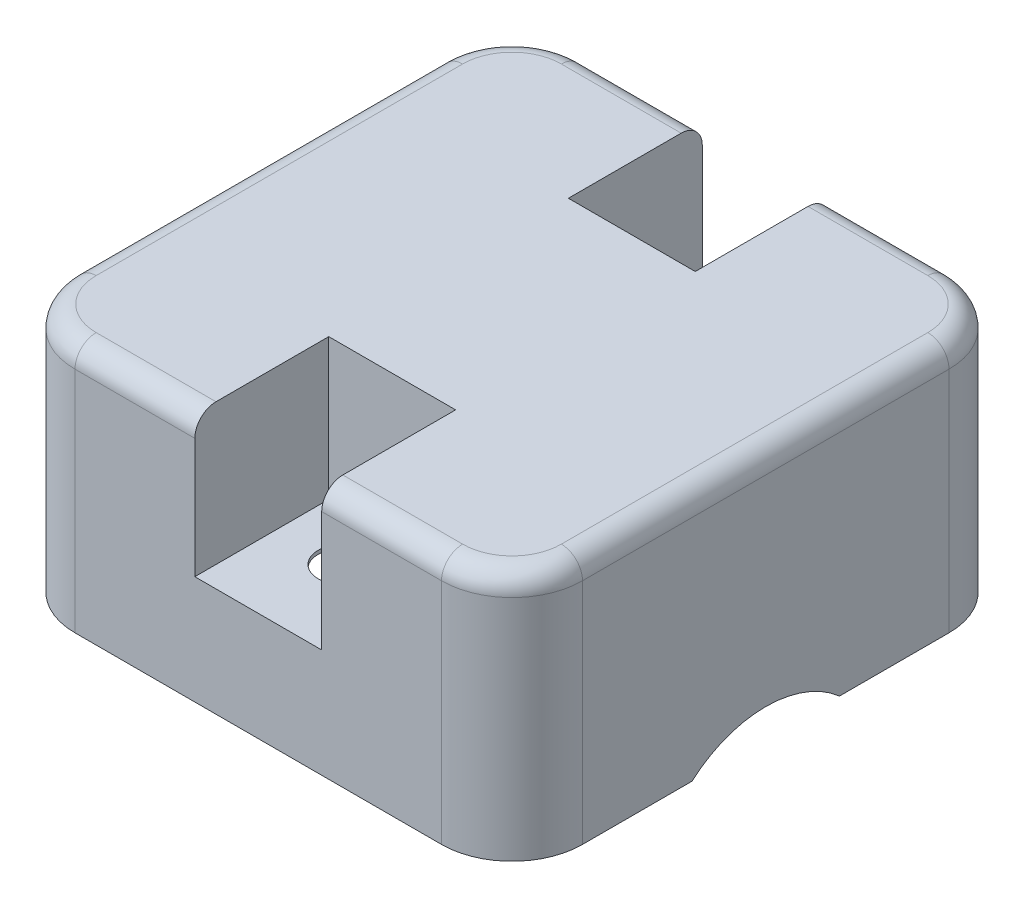
from build123d import *

# Parameters (mm, degrees)
BOSS_EXTRUDE1_DEPTH = 20
BOSS_EXTRUDE2_DEPTH = 2
SKETCH5_W           = 20
SKETCH5_H           = 20
SKETCH5_R           = 3.5
BOSS_EXTRUDE3_DEPTH = 22
SKETCH6_W           = 18
SKETCH6_H           = 19
CUT_EXTRUDE1_DEPTH  = 20
SKETCH7_W           = 20
SKETCH7_H           = 19
CUT_EXTRUDE2_DEPTH  = 1.5
FILLET1_R           = 3
SKETCH8_R           = 15.7
CUT_EXTRUDE3_DEPTH  = 121.5
BOSS_EXTRUDE6_START = 13.4
BOSS_EXTRUDE6_DEPTH = 13.4
SKETCH12_W          = 1
SKETCH12_H          = 30.481485494
BOSS_EXTRUDE7_DEPTH = 23.4
CUT_EXTRUDE4_DEPTH  = 93.4


with BuildPart() as part:
    # Sketch3 → Boss-Extrude1 (new body)
    with BuildSketch(Plane(origin=(0, 0, 0), x_dir=(1, 0, 0), z_dir=(0, 1, 0))):
        with BuildLine():
            Line((36, -26), (36, 26))
            ThreePointArc((36, 26), (33.071067812, 33.071067812), (26, 36))
            Line((26, 36), (-26, 36))
            ThreePointArc((-26, 36), (-33.071067812, 33.071067812), (-36, 26))
            Line((-36, 26), (-36, -26))
            ThreePointArc((-36, -26), (-33.071067812, -33.071067812), (-26, -36))
            Line((-26, -36), (26, -36))
            ThreePointArc((26, -36), (33.071067812, -33.071067812), (36, -26))
        make_face()
        with BuildLine():
            Line((-35, 25), (-35, -25))
            ThreePointArc((-35, -25), (-32.071067812, -32.071067812), (-25, -35))
            Line((-25, -35), (25, -35))
            ThreePointArc((25, -35), (32.071067812, -32.071067812), (35, -25))
            Line((35, -25), (35, 25))
            ThreePointArc((35, 25), (32.071067812, 32.071067812), (25, 35))
            Line((25, 35), (-25, 35))
            ThreePointArc((-25, 35), (-32.071067812, 32.071067812), (-35, 25))
        make_face(mode=Mode.SUBTRACT)
    extrude(amount=BOSS_EXTRUDE1_DEPTH)

    # Sketch4 → Boss-Extrude2 (add)
    with BuildSketch(Plane(origin=(0, 20, 0), x_dir=(1, 0, 0), z_dir=(0, 1, 0))):
        with BuildLine():
            Line((0, 36), (0, 0))
            Line((0, 0), (-36, 0))
            Line((-36, 0), (-36, -26))
            ThreePointArc((-36, -26), (-33.071067812, -33.071067812), (-26, -36))
            Line((-26, -36), (26, -36))
            ThreePointArc((26, -36), (33.071067812, -33.071067812), (36, -26))
            Line((36, -26), (36, 26))
            ThreePointArc((36, 26), (33.071067812, 33.071067812), (26, 36))
            Line((26, 36), (0, 36))
        make_face()
        with BuildLine():
            Line((-36, 0), (0, 0))
            Line((0, 0), (0, 36))
            Line((0, 36), (-26, 36))
            ThreePointArc((-26, 36), (-33.071067812, 33.071067812), (-36, 26))
            Line((-36, 26), (-36, 0))
        make_face()
    extrude(amount=BOSS_EXTRUDE2_DEPTH)

    # Sketch5 → Boss-Extrude3 (add)
    # profile 1 of 2: a face of its own
    with BuildSketch(Plane(origin=(0, 22, 0), x_dir=(1, 0, 0), z_dir=(0, 1, 0))):
        with Locations((0, 26)):
            Rectangle(SKETCH5_W, SKETCH5_H)
        with Locations(Location((0, 24, 0), (0, 0, 270))):
            Circle(SKETCH5_R, mode=Mode.SUBTRACT)
    # profile 2 of 2: a face of its own
    with BuildSketch(Plane(origin=(0, 22, 0), x_dir=(1, 0, 0), z_dir=(0, 1, 0))):
        with Locations((0, -26)):
            Rectangle(SKETCH5_W, SKETCH5_H)
        with Locations(Location((0, -24, 0), (0, 0, 270))):
            Circle(SKETCH5_R, mode=Mode.SUBTRACT)
    extrude(amount=-BOSS_EXTRUDE3_DEPTH)

    # Sketch6 → Cut-Extrude1 (cut)
    with BuildSketch(Plane(origin=(0, 22, 0), x_dir=(1, 0, 0), z_dir=(0, 1, 0))):
        Polygon((0, -17), (-9, -17), (-9, -36), (9, -36), (9, -17), align=None)
        with Locations((0, 26.5)):
            Rectangle(SKETCH6_W, SKETCH6_H)
    extrude(amount=-CUT_EXTRUDE1_DEPTH, mode=Mode.SUBTRACT)

    # Sketch7 → Cut-Extrude2 (cut)
    with BuildSketch(Plane(origin=(0, 0, 0), x_dir=(-1, 0, 0), z_dir=(0, -1, 0))):
        with Locations((0, 25.5)):
            Rectangle(SKETCH7_W, SKETCH7_H)
        with Locations((0, -25.5)):
            Rectangle(SKETCH7_W, SKETCH7_H)
    extrude(amount=-CUT_EXTRUDE2_DEPTH, mode=Mode.SUBTRACT)

    # Fillet1
    fillet1_edges = [part.edges().sort_by_distance(p)[0] for p in [
        (-17.5, 22, 36),
        (-17.5, 22, -36),
        (-33.071067812, 22, 33.071067812),
        (17.5, 22, 36),
        (36, 22, 0),
        (33.071067812, 22, -33.071067812),
        (17.5, 22, -36),
        (-33.071067812, 22, -33.071067812),
        (-36, 22, 0),
        (33.071067812, 22, 33.071067812),
    ]]
    fillet(fillet1_edges, radius=FILLET1_R)

    # Sketch8 → Cut-Extrude3 (cut)
    with BuildSketch(Plane(origin=(36, 0, 0), x_dir=(0, 0, -1), z_dir=(1, 0, 0))):
        with Locations((0, -12.6)):
            Circle(SKETCH8_R)
    extrude(amount=-CUT_EXTRUDE3_DEPTH, mode=Mode.SUBTRACT)

    # Sketch9 → Boss-Extrude6 (add)
    with BuildSketch(Plane(origin=(0, 0, 0), x_dir=(-1, 0, 0), z_dir=(0, -1, 0)).offset(BOSS_EXTRUDE6_START)):
        with BuildLine():
            Line((26, 36), (-26, 36))
            ThreePointArc((-26, 36), (-33.071067812, 33.071067812), (-36, 26))
            Line((-36, 26), (-36, -26))
            ThreePointArc((-36, -26), (-33.071067812, -33.071067812), (-26, -36))
            Line((-26, -36), (26, -36))
            ThreePointArc((26, -36), (33.071067812, -33.071067812), (36, -26))
            Line((36, -26), (36, 26))
            ThreePointArc((36, 26), (33.071067812, 33.071067812), (26, 36))
        make_face()
        with BuildLine():
            ThreePointArc((25, 35), (32.071067812, 32.071067812), (35, 25))
            Line((35, 25), (35, -25))
            ThreePointArc((35, -25), (32.071067812, -32.071067812), (25, -35))
            Line((25, -35), (-25, -35))
            ThreePointArc((-25, -35), (-32.071067812, -32.071067812), (-35, -25))
            Line((-35, -25), (-35, 25))
            ThreePointArc((-35, 25), (-32.071067812, 32.071067812), (-25, 35))
            Line((-25, 35), (25, 35))
        make_face(mode=Mode.SUBTRACT)
    extrude(amount=-BOSS_EXTRUDE6_DEPTH)

    # Sketch12 → Boss-Extrude7 (add)
    with BuildSketch(Plane.XZ.offset(13.4)):
        with Locations((-35.5, 0.993188546)):
            Rectangle(SKETCH12_W, SKETCH12_H)
        with Locations((35.5, 0.993188546)):
            Rectangle(SKETCH12_W, SKETCH12_H)
    extrude(amount=-BOSS_EXTRUDE7_DEPTH)

    # Sketch13 → Cut-Extrude4 (cut)
    with BuildSketch(Plane.ZY.offset(36)):
        with BuildLine():
            Line((-10.476256632, -13.4), (0, -13.4))
            Line((0, -13.4), (0, -9.460687563))
            ThreePointArc((0, -9.460687563), (-5.596207097, -10.478064604), (-10.476256632, -13.4))
        make_face()
        with BuildLine():
            Line((0, -9.460687563), (0, -13.4))
            Line((0, -13.4), (10.476256632, -13.4))
            ThreePointArc((10.476256632, -13.4), (5.596207097, -10.478064604), (0, -9.460687563))
        make_face()
    extrude(amount=-CUT_EXTRUDE4_DEPTH, mode=Mode.SUBTRACT)


solid = part.part
